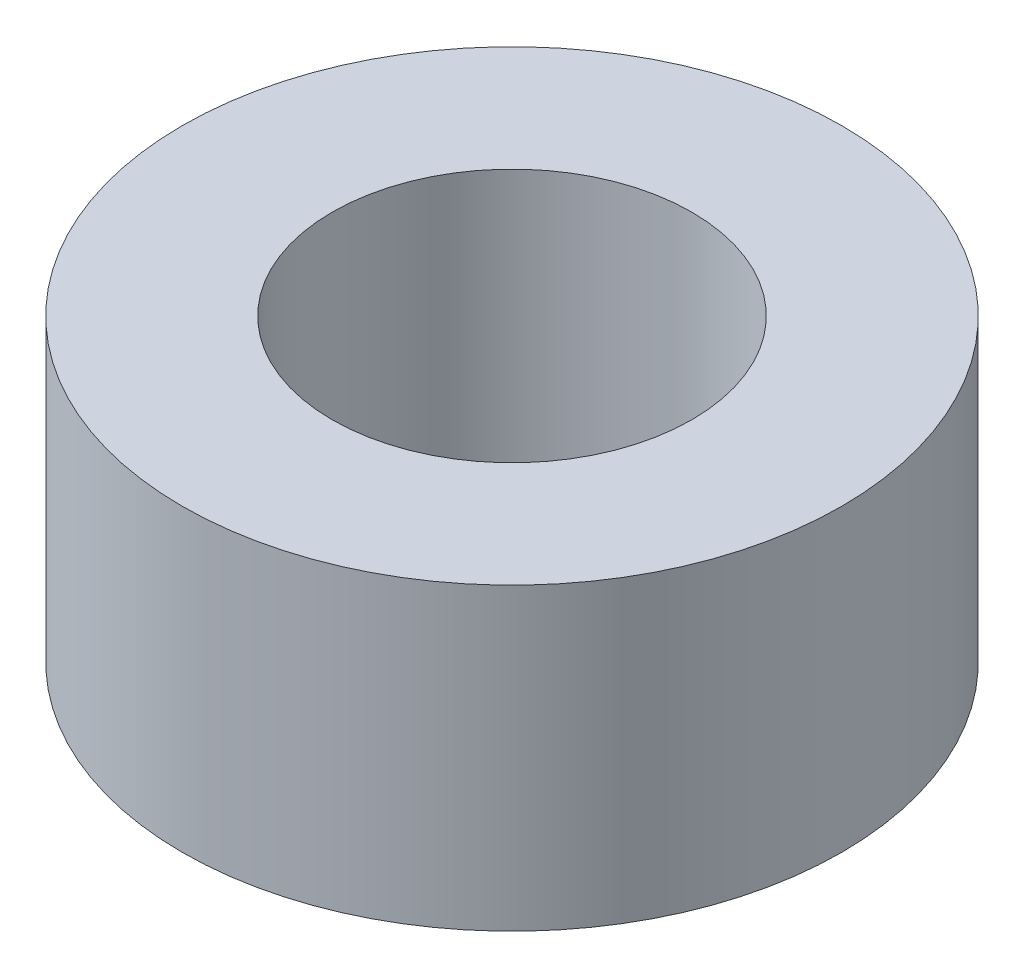
from build123d import *

# Parameters (mm, degrees)
SKETCH1_R           = 3.3
SKETCH1_R_2         = 1.8
BOSS_EXTRUDE1_DEPTH = 3


with BuildPart() as part:
    # Sketch1 → Boss-Extrude1 (new body)
    with BuildSketch(Plane(origin=(0, 0, 0), x_dir=(1, 0, 0), z_dir=(0, 1, 0))):
        with Locations(Location((0, 0, 0), (0, 0, 270))):
            Circle(SKETCH1_R)
        with Locations(Location((0, 0, 0), (0, 0, 270))):
            Circle(SKETCH1_R_2, mode=Mode.SUBTRACT)
    extrude(amount=BOSS_EXTRUDE1_DEPTH)


solid = part.part
